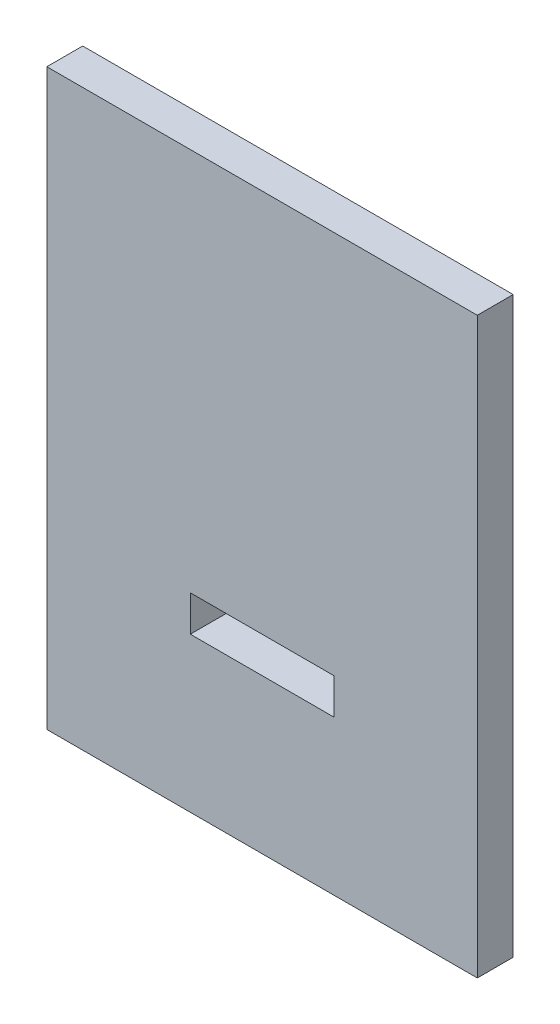
from build123d import *

# Parameters (mm, degrees)
FRAME_OUTLINE_W     = 3
FRAME_OUTLINE_H     = 4
FRAME_OUTLINE_W_2   = 1
FRAME_OUTLINE_H_2   = 0.25
BOSS_EXTRUDE1_DEPTH = 0.125


with BuildPart() as part:
    # frame_outline → Boss-Extrude1 (new, symmetric)
    with BuildSketch(Plane.XY):
        with Locations((1.5, 2)):
            Rectangle(FRAME_OUTLINE_W, FRAME_OUTLINE_H)
        with Locations((1.5, 1.2)):
            Rectangle(FRAME_OUTLINE_W_2, FRAME_OUTLINE_H_2, mode=Mode.SUBTRACT)
    extrude(amount=BOSS_EXTRUDE1_DEPTH, both=True)


solid = part.part
